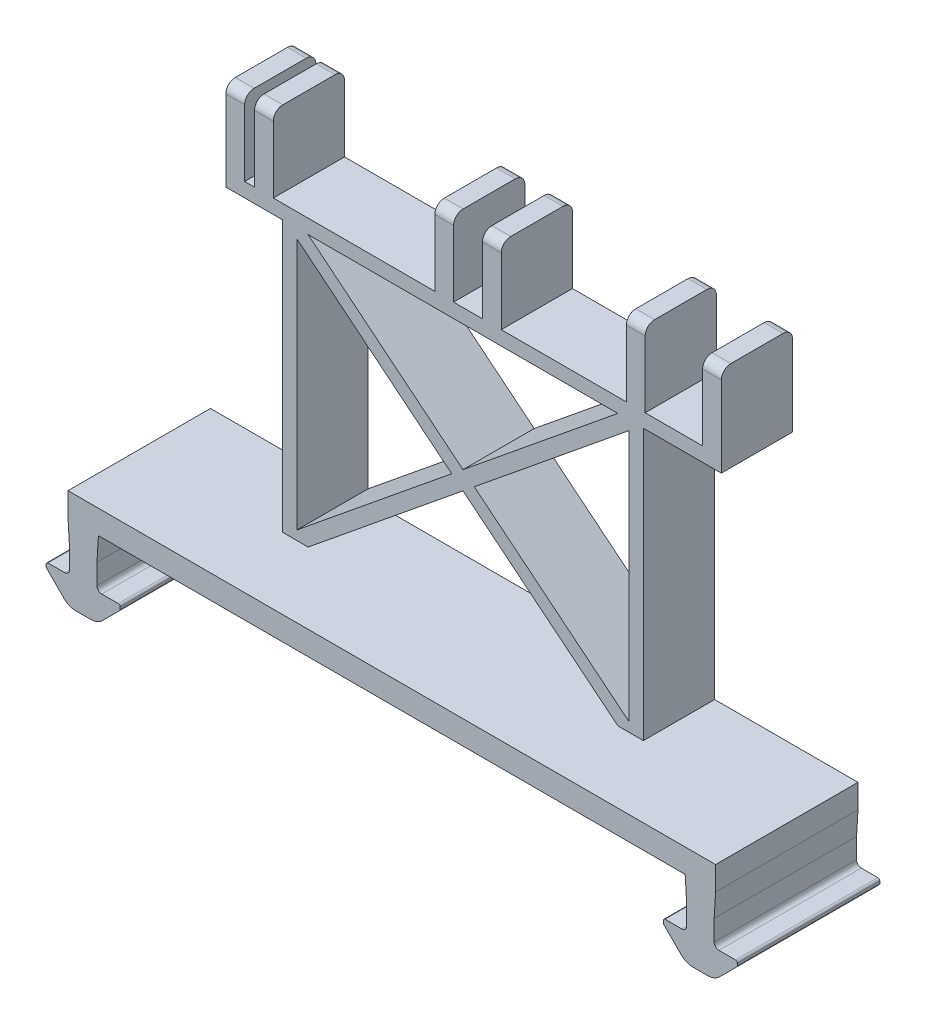
from build123d import *

# Parameters (mm, degrees)
BOSS_EXTRUDE2_DEPTH  = 38.1
BOSS_EXTRUDE6_DEPTH  = 19.05
SKETCH6_W            = 5.08
SKETCH6_H            = 19.05
BOSS_EXTRUDE5_DEPTH  = 20.32
SKETCH10_W           = 23.1648
SKETCH10_H           = 3.81
SKETCH10_W_2         = 17.5006
CUT_EXTRUDE3_DEPTH   = 19.05
FILLET1_R            = 2.54
BOSS_EXTRUDE7_DEPTH  = 19.05
CLEARANCE_START      = -38.1
SKETCH3_W            = 2.6416
SKETCH3_H            = 20.32
SKETCH3_W_2          = 7.7216
SKETCH3_W_3          = 15.3416
CLEARANCE_TRIM_DEPTH = 38.1


with BuildPart() as part:
    # Sketch1 → Boss-Extrude2 (new body)
    with BuildSketch(Plane.XY):
        with BuildLine():
            Line((-2.016886463, 6.858), (2.016886463, 6.858))
            ThreePointArc((2.016886463, 6.858), (3.83455623, 7.219556996), (5.375502252, 8.249184211))
            Line((5.375502252, 8.249184211), (10.026617928, 12.900299887))
            ThreePointArc((10.026617928, 12.900299887), (10.219328904, 13.188712244), (10.287, 13.528917816))
            Line((10.287, 13.528917816), (10.287, 14.097877816))
            ThreePointArc((10.287, 14.097877816), (10.026617928, 14.726495744), (9.398, 14.986877816))
            Line((9.398, 14.986877816), (4.953, 14.986877816))
            ThreePointArc((4.953, 14.986877816), (4.324382072, 15.247259887), (4.064, 15.875877816))
            Line((4.064, 15.875877816), (4.064, 27.686877816))
            Line((4.064, 27.686877816), (161.036, 27.686877816))
            Line((161.036, 27.686877816), (161.036, 15.875877816))
            ThreePointArc((161.036, 15.875877816), (160.775617928, 15.247259887), (160.147, 14.986877816))
            Line((160.147, 14.986877816), (155.702, 14.986877816))
            ThreePointArc((155.702, 14.986877816), (155.073382072, 14.726495744), (154.813, 14.097877816))
            Line((154.813, 14.097877816), (154.813, 13.528917816))
            ThreePointArc((154.813, 13.528917816), (154.880671096, 13.188712244), (155.073382072, 12.900299887))
            Line((155.073382072, 12.900299887), (159.724497748, 8.249184211))
            ThreePointArc((159.724497748, 8.249184211), (161.26544377, 7.219556996), (163.083113537, 6.858))
            Line((163.083113537, 6.858), (167.116886463, 6.858))
            ThreePointArc((167.116886463, 6.858), (168.93455623, 7.219556996), (170.475502252, 8.249184211))
            Line((170.475502252, 8.249184211), (175.126617928, 12.900299887))
            ThreePointArc((175.126617928, 12.900299887), (175.319328904, 13.188712244), (175.387, 13.528917816))
            Line((175.387, 13.528917816), (175.387, 14.097877816))
            ThreePointArc((175.387, 14.097877816), (175.126617928, 14.726495744), (174.498, 14.986877816))
            Line((174.498, 14.986877816), (170.053, 14.986877816))
            ThreePointArc((170.053, 14.986877816), (169.424382072, 15.247259887), (169.164, 15.875877816))
            Line((169.164, 15.875877816), (169.164, 27.686877816))
            Line((169.164, 27.686877816), (169.164, 34.036877816))
            Line((169.164, 34.036877816), (-4.064, 34.036877816))
            Line((-4.064, 34.036877816), (-4.064, 27.686877816))
            Line((-4.064, 27.686877816), (-4.064, 15.875877816))
            ThreePointArc((-4.064, 15.875877816), (-4.324382072, 15.247259887), (-4.953, 14.986877816))
            Line((-4.953, 14.986877816), (-9.398, 14.986877816))
            ThreePointArc((-9.398, 14.986877816), (-10.026617928, 14.726495744), (-10.287, 14.097877816))
            Line((-10.287, 14.097877816), (-10.287, 13.528917816))
            ThreePointArc((-10.287, 13.528917816), (-10.219328904, 13.188712244), (-10.026617928, 12.900299887))
            Line((-10.026617928, 12.900299887), (-5.375502252, 8.249184211))
            ThreePointArc((-5.375502252, 8.249184211), (-3.83455623, 7.219556996), (-2.016886463, 6.858))
        make_face()
    extrude(amount=BOSS_EXTRUDE2_DEPTH)

    # Sketch7 → Boss-Extrude6 (add)
    with BuildSketch(Plane.XY):
        Polygon((130.81, 106.426877816), (169.164, 106.426877816), (169.164, 110.236877816), (-4.064, 110.236877816), (-4.064, 106.426877816), (34.29, 106.426877816), (34.29, 34.036877816), (38.1, 34.036877816), (38.1, 106.426877816), (127, 106.426877816), (127, 34.036877816), (130.81, 34.036877816), align=None)
    extrude(amount=BOSS_EXTRUDE6_DEPTH)

    # Sketch6 → Boss-Extrude5 (add)
    with BuildSketch(Plane(origin=(0, 110.236877816, 0), x_dir=(1, 0, 0), z_dir=(0, 1, 0))):
        with Locations((21.6408, -9.525)):
            Rectangle(SKETCH6_W, SKETCH6_H)
        with Locations((29.2608, -9.525)):
            Rectangle(SKETCH6_W, SKETCH6_H)
        with Locations((77.5462, -9.525)):
            Rectangle(SKETCH6_W, SKETCH6_H)
        with Locations((90.2462, -9.525)):
            Rectangle(SKETCH6_W, SKETCH6_H)
        with Locations((128.8034, -9.525)):
            Rectangle(SKETCH6_W, SKETCH6_H)
        with Locations((149.1234, -9.525)):
            Rectangle(SKETCH6_W, SKETCH6_H)
    extrude(amount=BOSS_EXTRUDE5_DEPTH)

    # Sketch10 → Cut-Extrude3 (cut)
    with BuildSketch(Plane.XY):
        with Locations((7.5184, 108.331877816)):
            Rectangle(SKETCH10_W, SKETCH10_H)
        with Locations((160.4137, 108.331877816)):
            Rectangle(SKETCH10_W_2, SKETCH10_H)
    extrude(amount=CUT_EXTRUDE3_DEPTH, mode=Mode.SUBTRACT)

    # Fillet1
    fillet1_edges = [part.edges().sort_by_distance(p)[0] for p in [
        (21.6408, 130.556877816, 19.05),
        (21.6408, 130.556877816, 0),
        (29.2608, 130.556877816, 0),
        (29.2608, 130.556877816, 19.05),
        (77.5462, 130.556877816, 0),
        (77.5462, 130.556877816, 19.05),
        (90.2462, 130.556877816, 0),
        (90.2462, 130.556877816, 19.05),
        (128.8034, 130.556877816, 0),
        (128.8034, 130.556877816, 19.05),
        (149.1234, 130.556877816, 0),
        (149.1234, 130.556877816, 19.05),
    ]]
    fillet(fillet1_edges, radius=FILLET1_R)

    # Sketch11 → Boss-Extrude7 (add)
    with BuildSketch(Plane.XY):
        Polygon((38.1, 103.970194938), (79.533021028, 70.231877816), (38.1, 36.493560693), (38.1, 34.036877816), (41.116978972, 34.036877816), (82.55, 67.775194938), (123.983021028, 34.036877816), (127, 34.036877816), (127, 36.493560693), (85.566978972, 70.231877816), (127, 103.970194938), (127, 106.426877816), (123.983021028, 106.426877816), (82.55, 72.688560693), (41.116978972, 106.426877816), (38.1, 106.426877816), align=None)
    extrude(amount=BOSS_EXTRUDE7_DEPTH)

    # Sketch3 → Clearance Trim (cut)
    with BuildSketch(Plane.XY.offset(38.1).offset(CLEARANCE_START)):
        with BuildLine():
            Line((4.064, 27.686877816), (3.683, 21.336877816))
            Line((3.683, 21.336877816), (3.683, 15.875877816))
            ThreePointArc((3.683, 15.875877816), (4.054974388, 14.977852204), (4.953, 14.605877816))
            Line((4.953, 14.605877816), (9.398, 14.605877816))
            ThreePointArc((9.398, 14.605877816), (9.757210245, 14.457088061), (9.906, 14.097877816))
            Line((9.906, 14.097877816), (9.906, 13.528917816))
            ThreePointArc((9.906, 13.528917816), (9.867330803, 13.334514632), (9.757210245, 13.169707571))
            Line((9.757210245, 13.169707571), (5.106094568, 8.518591894))
            ThreePointArc((5.106094568, 8.518591894), (3.688753842, 7.571555098), (2.016886463, 7.239))
            Line((2.016886463, 7.239), (-2.016886463, 7.239))
            ThreePointArc((-2.016886463, 7.239), (-3.688753842, 7.571555098), (-5.106094568, 8.518591894))
            Line((-5.106094568, 8.518591894), (-9.757210245, 13.169707571))
            ThreePointArc((-9.757210245, 13.169707571), (-9.867330803, 13.334514632), (-9.906, 13.528917816))
            Line((-9.906, 13.528917816), (-9.906, 14.097877816))
            ThreePointArc((-9.906, 14.097877816), (-9.757210245, 14.457088061), (-9.398, 14.605877816))
            Line((-9.398, 14.605877816), (-4.953, 14.605877816))
            ThreePointArc((-4.953, 14.605877816), (-4.054974388, 14.977852204), (-3.683, 15.875877816))
            Line((-3.683, 15.875877816), (-3.683, 21.336877816))
            Line((-3.683, 21.336877816), (-4.064, 27.686877816))
            Line((-4.064, 27.686877816), (-4.064, 15.875877816))
            ThreePointArc((-4.064, 15.875877816), (-4.324382072, 15.247259887), (-4.953, 14.986877816))
            Line((-4.953, 14.986877816), (-9.398, 14.986877816))
            ThreePointArc((-9.398, 14.986877816), (-10.026617928, 14.726495744), (-10.287, 14.097877816))
            Line((-10.287, 14.097877816), (-10.287, 13.528917816))
            ThreePointArc((-10.287, 13.528917816), (-10.219328904, 13.188712244), (-10.026617928, 12.900299887))
            Line((-10.026617928, 12.900299887), (-5.375502252, 8.249184211))
            ThreePointArc((-5.375502252, 8.249184211), (-3.83455623, 7.219556996), (-2.016886463, 6.858))
            Line((-2.016886463, 6.858), (2.016886463, 6.858))
            ThreePointArc((2.016886463, 6.858), (3.83455623, 7.219556996), (5.375502252, 8.249184211))
            Line((5.375502252, 8.249184211), (10.026617928, 12.900299887))
            ThreePointArc((10.026617928, 12.900299887), (10.219328904, 13.188712244), (10.287, 13.528917816))
            Line((10.287, 13.528917816), (10.287, 14.097877816))
            ThreePointArc((10.287, 14.097877816), (10.026617928, 14.726495744), (9.398, 14.986877816))
            Line((9.398, 14.986877816), (4.953, 14.986877816))
            ThreePointArc((4.953, 14.986877816), (4.324382072, 15.247259887), (4.064, 15.875877816))
            Line((4.064, 15.875877816), (4.064, 27.686877816))
        make_face()
        with BuildLine():
            Line((161.036, 27.686877816), (161.417, 21.336877816))
            Line((161.417, 21.336877816), (161.417, 15.875877816))
            ThreePointArc((161.417, 15.875877816), (161.045025612, 14.977852204), (160.147, 14.605877816))
            Line((160.147, 14.605877816), (155.702, 14.605877816))
            ThreePointArc((155.702, 14.605877816), (155.342789755, 14.457088061), (155.194, 14.097877816))
            Line((155.194, 14.097877816), (155.194, 13.528917816))
            ThreePointArc((155.194, 13.528917816), (155.232669197, 13.334514632), (155.342789755, 13.169707571))
            Line((155.342789755, 13.169707571), (159.993905432, 8.518591894))
            ThreePointArc((159.993905432, 8.518591894), (161.411246158, 7.571555098), (163.083113537, 7.239))
            Line((163.083113537, 7.239), (167.116886463, 7.239))
            ThreePointArc((167.116886463, 7.239), (168.788753842, 7.571555098), (170.206094568, 8.518591894))
            Line((170.206094568, 8.518591894), (174.857210245, 13.169707571))
            ThreePointArc((174.857210245, 13.169707571), (174.967330803, 13.334514632), (175.006, 13.528917816))
            Line((175.006, 13.528917816), (175.006, 14.097877816))
            ThreePointArc((175.006, 14.097877816), (174.857210245, 14.457088061), (174.498, 14.605877816))
            Line((174.498, 14.605877816), (170.053, 14.605877816))
            ThreePointArc((170.053, 14.605877816), (169.154974388, 14.977852204), (168.783, 15.875877816))
            Line((168.783, 15.875877816), (168.783, 21.336877816))
            Line((168.783, 21.336877816), (169.164, 27.686877816))
            Line((169.164, 27.686877816), (169.164, 15.875877816))
            ThreePointArc((169.164, 15.875877816), (169.424382072, 15.247259887), (170.053, 14.986877816))
            Line((170.053, 14.986877816), (174.498, 14.986877816))
            ThreePointArc((174.498, 14.986877816), (175.126617928, 14.726495744), (175.387, 14.097877816))
            Line((175.387, 14.097877816), (175.387, 13.528917816))
            ThreePointArc((175.387, 13.528917816), (175.319328904, 13.188712244), (175.126617928, 12.900299887))
            Line((175.126617928, 12.900299887), (170.475502252, 8.249184211))
            ThreePointArc((170.475502252, 8.249184211), (168.93455623, 7.219556996), (167.116886463, 6.858))
            Line((167.116886463, 6.858), (163.083113537, 6.858))
            ThreePointArc((163.083113537, 6.858), (161.26544377, 7.219556996), (159.724497748, 8.249184211))
            Line((159.724497748, 8.249184211), (155.073382072, 12.900299887))
            ThreePointArc((155.073382072, 12.900299887), (154.880671096, 13.188712244), (154.813, 13.528917816))
            Line((154.813, 13.528917816), (154.813, 14.097877816))
            ThreePointArc((154.813, 14.097877816), (155.073382072, 14.726495744), (155.702, 14.986877816))
            Line((155.702, 14.986877816), (160.147, 14.986877816))
            ThreePointArc((160.147, 14.986877816), (160.775617928, 15.247259887), (161.036, 15.875877816))
            Line((161.036, 15.875877816), (161.036, 27.686877816))
        make_face()
        with Locations((25.4508, 120.396877816)):
            Rectangle(SKETCH3_W, SKETCH3_H)
        with Locations((83.8962, 120.396877816)):
            Rectangle(SKETCH3_W_2, SKETCH3_H)
        with Locations((138.9634, 120.396877816)):
            Rectangle(SKETCH3_W_3, SKETCH3_H)
    extrude(amount=CLEARANCE_TRIM_DEPTH, mode=Mode.SUBTRACT)


solid = part.part
